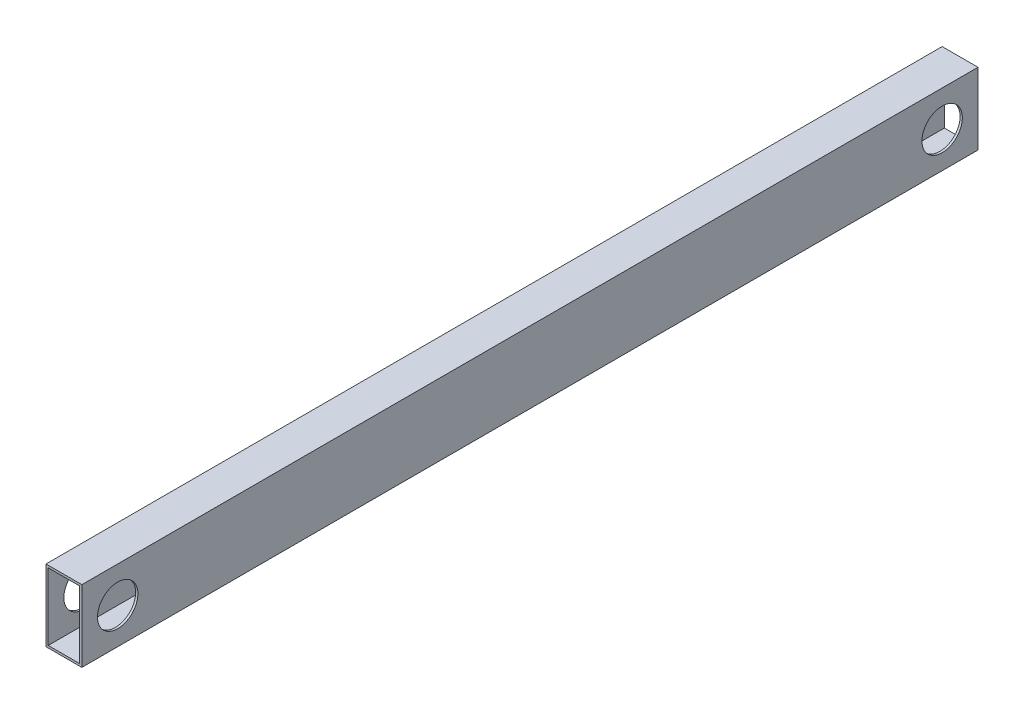
from build123d import *

# Parameters (mm, degrees)
SKETCH1_W               = 25.4
SKETCH1_H               = 50.8
SKETCH1_W_2             = 22.225
SKETCH1_H_2             = 47.625
BOSS_EXTRUDE1_DEPTH     = 635
CUT_EXTRUDE1_DEPTH      = 638.534940219
CUT_EXTRUDE1_DEPTH_BACK = 638.534940219
SKETCH2_R               = 14.3129


with BuildPart() as part:
    # Sketch1 → Boss-Extrude1 (new body)
    with BuildSketch(Plane.XY):
        with Locations((12.7, 25.4)):
            Rectangle(SKETCH1_W, SKETCH1_H)
        with Locations((12.7, 25.4)):
            Rectangle(SKETCH1_W_2, SKETCH1_H_2, mode=Mode.SUBTRACT)
    extrude(amount=BOSS_EXTRUDE1_DEPTH)

    # Sketch2 → Cut-Extrude1 (cut, two sides: drawn at the far end of the back side and taken through both)
    with BuildSketch(Plane(origin=(25.4, 0, 0), x_dir=(0, 0, -1), z_dir=(1, 0, 0)).offset(-CUT_EXTRUDE1_DEPTH_BACK)):
        with Locations((-25.4, 25.4)):
            Circle(SKETCH2_R)
        with Locations((-609.6, 25.4)):
            Circle(SKETCH2_R)
    extrude(amount=CUT_EXTRUDE1_DEPTH + CUT_EXTRUDE1_DEPTH_BACK, mode=Mode.SUBTRACT)


solid = part.part
